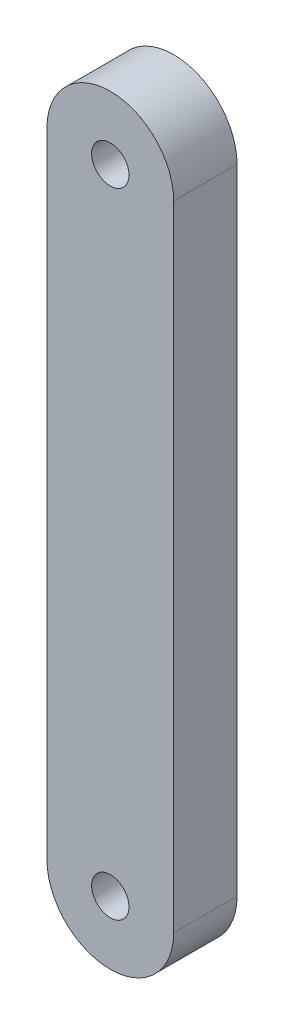
from build123d import *

# Parameters (mm, degrees)
BOSS_EXTRUDE1_DEPTH = 5
SKETCH2_R           = 1.475
CUT_EXTRUDE1_DEPTH  = 10


with BuildPart() as part:
    # Sketch1 → Boss-Extrude1 (new body)
    with BuildSketch(Plane.XY):
        with BuildLine():
            Line((5, 25), (5, -25))
            ThreePointArc((5, -25), (0, -30), (-5, -25))
            Line((-5, -25), (-5, 25))
            ThreePointArc((-5, 25), (0, 30), (5, 25))
        make_face()
    extrude(amount=BOSS_EXTRUDE1_DEPTH)

    # Sketch2 → Cut-Extrude1 (cut)
    with BuildSketch(Plane(origin=(0, 0, 0), x_dir=(-1, 0, 0), z_dir=(0, 0, -1))):
        with Locations((0, -25)):
            Circle(SKETCH2_R)
        with Locations((0, 25)):
            Circle(SKETCH2_R)
    extrude(amount=-CUT_EXTRUDE1_DEPTH, mode=Mode.SUBTRACT)


solid = part.part
